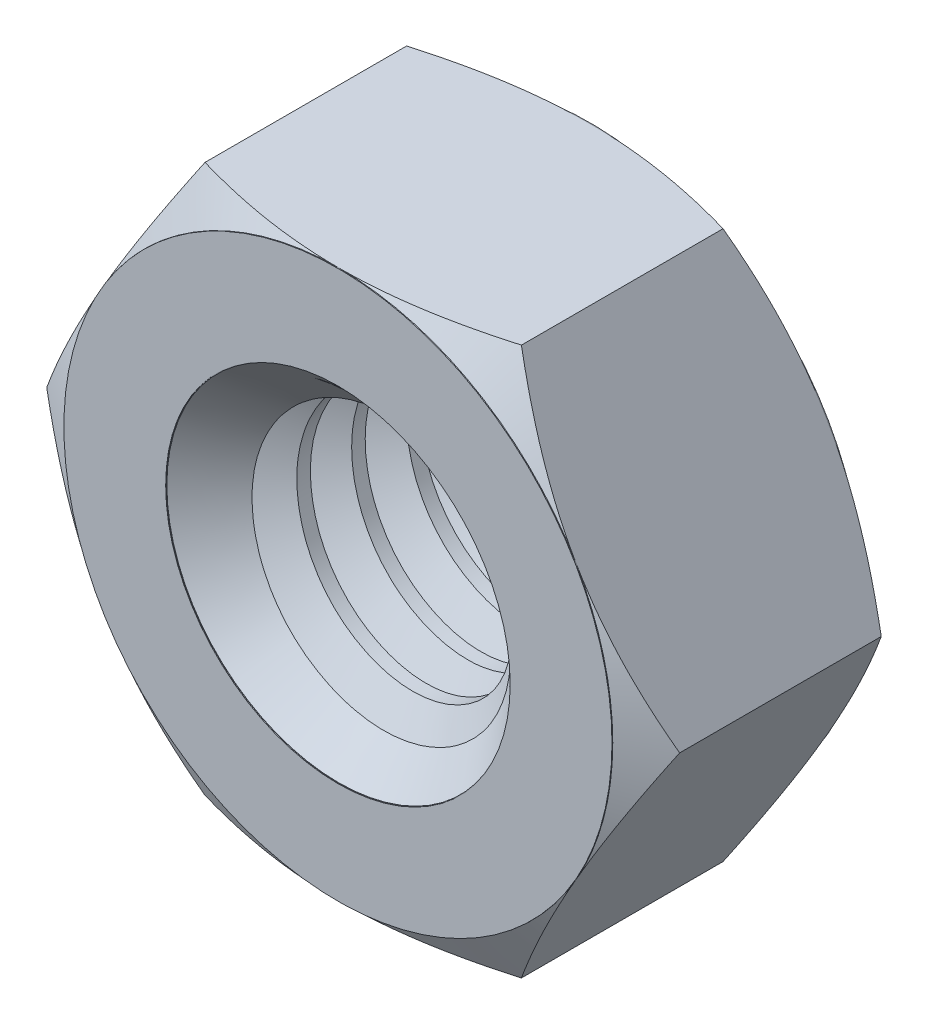
from build123d import *

# Parameters (mm, degrees)
Y_KSEKLIK_EKSTR_ZYON1_DEPTH = 3.2
IZIM2_OUTSIDE_W             = 23.4
IZIM2_OUTSIDE_H             = 22.318
IZIM2_OUTSIDE_R             = 3.5
KES_EKSTR_ZYON1_DEPTH       = 3.2
KES_EKSTR_ZYON1_DRAFT       = -60
IZIM3_OUTSIDE_W             = 23.4
IZIM3_OUTSIDE_H             = 22.318
IZIM3_OUTSIDE_R             = 3.5
KES_EKSTR_ZYON2_DEPTH       = 3.2
KES_EKSTR_ZYON2_DRAFT       = -60
IZIM5_R                     = 1.545
KES_EKSTR_ZYON3_DEPTH       = 3.2
PAH1_SIZE                   = 0.65
KES_S_P_R1_PITCH            = 0.7
KES_S_P_R1_HEIGHT           = 4
KES_S_P_R1_RADIUS           = 1.545
BOSS_EXTRUDE1_DEPTH         = 3.21
BOSS_EXTRUDE1_DEPTH_BACK    = 0.01
SKETCH1_R                   = 3.5
SKETCH1_R_2                 = 2.2


with BuildPart() as part:
    # Çizim1 → Yükseklik-Ekstrüzyon1 (new body)
    with BuildSketch(Plane.XY):
        Polygon((4.041451884, 0), (2.020725942, 3.5), (-2.020725942, 3.5), (-4.041451884, 0), (-2.020725942, -3.5), (2.020725942, -3.5), align=None)
    extrude(amount=Y_KSEKLIK_EKSTR_ZYON1_DEPTH)


with BuildPart() as kes_ekstr_zyon1_tool:
    # Çizim2 outside → Kes-Ekstrüzyon1 (with draft: the straight prism first)
    with BuildSketch(Plane.XY.offset(3.2)):
        Rectangle(IZIM2_OUTSIDE_W, IZIM2_OUTSIDE_H)
        Circle(IZIM2_OUTSIDE_R, mode=Mode.SUBTRACT)
    extrude(amount=-KES_EKSTR_ZYON1_DEPTH)
    # Kes-Ekstrüzyon1: the draft: its side faces are tilted about the plane it starts from
    kes_ekstr_zyon1_sides = [kes_ekstr_zyon1_tool.faces().sort_by_distance(p)[0] for p in [
        (0, -11.159, 1.6),
        (11.7, 0, 1.6),
        (0, 11.159, 1.6),
        (-11.7, 0, 1.6),
        (-3.5, 0, 1.6),
    ]]
    draft(kes_ekstr_zyon1_sides, Plane.XY.offset(3.2), KES_EKSTR_ZYON1_DRAFT)


with BuildPart() as part_1:
    add(part.part)

    # Kes-Ekstrüzyon1: cut by kes_ekstr_zyon1_tool
    add(kes_ekstr_zyon1_tool.part, mode=Mode.SUBTRACT)


with BuildPart() as kes_ekstr_zyon2_tool:
    # Çizim3 outside → Kes-Ekstrüzyon2 (with draft: the straight prism first)
    with BuildSketch(Plane(origin=(0, 0, 0), x_dir=(-1, 0, 0), z_dir=(0, 0, -1))):
        Rectangle(IZIM3_OUTSIDE_W, IZIM3_OUTSIDE_H)
        Circle(IZIM3_OUTSIDE_R, mode=Mode.SUBTRACT)
    extrude(amount=-KES_EKSTR_ZYON2_DEPTH)
    # Kes-Ekstrüzyon2: the draft: its side faces are tilted about the plane it starts from
    kes_ekstr_zyon2_sides = [kes_ekstr_zyon2_tool.faces().sort_by_distance(p)[0] for p in [
        (0, -11.159, 1.6),
        (-11.7, 0, 1.6),
        (0, 11.159, 1.6),
        (11.7, 0, 1.6),
        (3.5, 0, 1.6),
    ]]
    draft(kes_ekstr_zyon2_sides, Plane(origin=(0, 0, 0), x_dir=(-1, 0, 0), z_dir=(0, 0, -1)), KES_EKSTR_ZYON2_DRAFT)


with BuildPart() as part_2:
    add(part_1.part)

    # Kes-Ekstrüzyon2: cut by kes_ekstr_zyon2_tool
    add(kes_ekstr_zyon2_tool.part, mode=Mode.SUBTRACT)

    # Çizim5 → Kes-Ekstrüzyon3 (cut)
    with BuildSketch(Plane(origin=(0, 0, 0), x_dir=(-1, 0, 0), z_dir=(0, 0, -1))):
        Circle(IZIM5_R)
    extrude(amount=-KES_EKSTR_ZYON3_DEPTH, mode=Mode.SUBTRACT)

    # Pah1
    pah1_edges = [part_2.edges().sort_by_distance(p)[0] for p in [
        (1.545, 0, 3.2),
        (1.545, 0, 0),
    ]]
    chamfer(pah1_edges, length=PAH1_SIZE)

    # Kes-Süpür1: sweep along a helix
    with BuildLine() as kes_s_p_r1_path:
        Helix(KES_S_P_R1_PITCH, KES_S_P_R1_HEIGHT, KES_S_P_R1_RADIUS, center=(0, 0, 0), direction=(0, 0, 1))
    # Çizim7 → Kes-Süpür1 (sweep, cut)
    with BuildSketch(Plane(origin=(-0.343794843, -1.506263624, 4), x_dir=(0.07011904852635167, -0.016004215256580363, -0.9974102386319182), z_dir=(0.9724030815382076, -0.22194465783789016, 0.07192229051010418))):
        Polygon((0.347294283, 0.146531344), (-0.347294283, 0.146531344), (0, -0.455), align=None)
    sweep(path=kes_s_p_r1_path.line, is_frenet=True, mode=Mode.SUBTRACT)

    # Sketch1 → Boss-Extrude1 (add, two sides: drawn at the far end of the back side and taken through both)
    with BuildSketch(Plane.XY.offset(-BOSS_EXTRUDE1_DEPTH_BACK)):
        Circle(SKETCH1_R)
        Circle(SKETCH1_R_2, mode=Mode.SUBTRACT)
    extrude(amount=BOSS_EXTRUDE1_DEPTH + BOSS_EXTRUDE1_DEPTH_BACK)


solid = part_2.part
